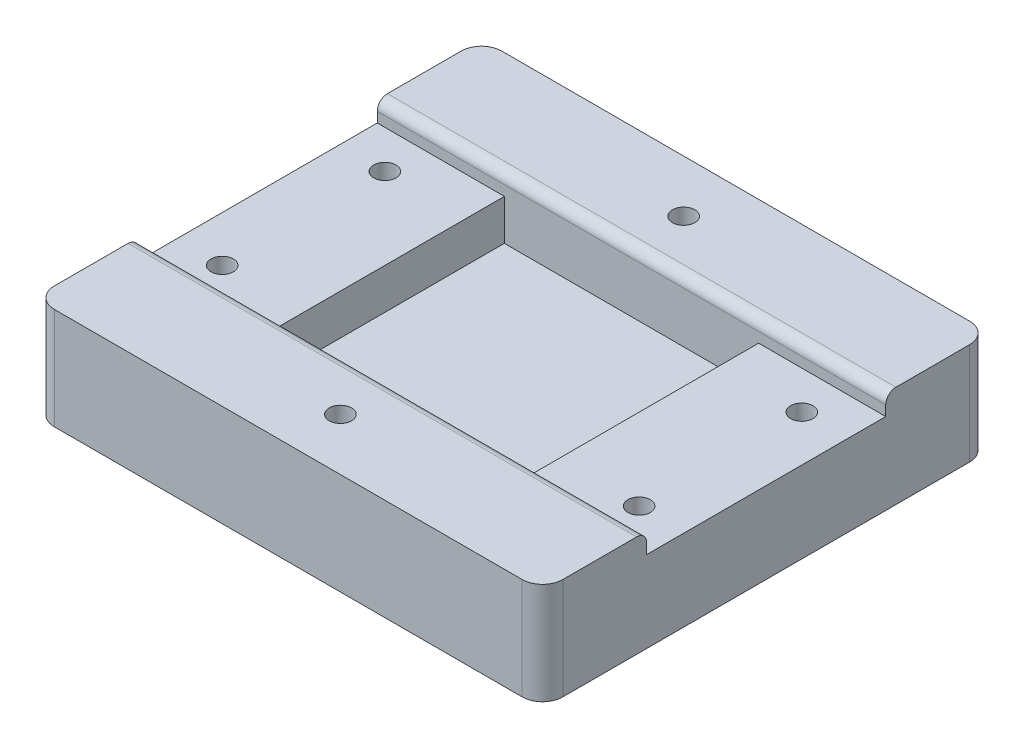
from build123d import *

# Parameters (mm, degrees)
CROQUIS1_W              = 50
CROQUIS1_H              = 44
SALIENTE_EXTRUIR1_DEPTH = 10
CROQUIS2_W              = 58
CROQUIS2_H              = 23.5
CORTAR_EXTRUIR2_DEPTH   = 2
CROQUIS3_W              = 25
CROQUIS3_H              = 23.5
CORTAR_EXTRUIR3_DEPTH   = 4
CROQUIS4_R              = 1.1
CORTAR_EXTRUIR4_DEPTH   = 5
CROQUIS5_R              = 1.1
CORTAR_EXTRUIR5_DEPTH   = 5
REDONDEO1_R             = 2
REDONDEO2_R             = 1


with BuildPart() as part:
    # Croquis1 → Saliente-Extruir1 (new body)
    with BuildSketch(Plane(origin=(0, 0, 0), x_dir=(1, 0, 0), z_dir=(0, 1, 0))):
        Rectangle(CROQUIS1_W, CROQUIS1_H)
    extrude(amount=SALIENTE_EXTRUIR1_DEPTH)

    # Croquis2 → Cortar-Extruir2 (cut)
    with BuildSketch(Plane(origin=(0, 10, 0), x_dir=(1, 0, 0), z_dir=(0, 1, 0))):
        Rectangle(CROQUIS2_W, CROQUIS2_H)
    extrude(amount=-CORTAR_EXTRUIR2_DEPTH, mode=Mode.SUBTRACT)

    # Croquis3 → Cortar-Extruir3 (cut)
    with BuildSketch(Plane(origin=(0, 8, 0), x_dir=(1, 0, 0), z_dir=(0, 1, 0))):
        Rectangle(CROQUIS3_W, CROQUIS3_H)
    extrude(amount=-CORTAR_EXTRUIR3_DEPTH, mode=Mode.SUBTRACT)

    # Croquis4 → Cortar-Extruir4 (cut)
    with BuildSketch(Plane(origin=(0, 8, 0), x_dir=(1, 0, 0), z_dir=(0, 1, 0))):
        with Locations(Location((-20.5, 8, 0), (0, 0, 270))):
            Circle(CROQUIS4_R)
        with Locations(Location((-20.5, -8, 0), (0, 0, 270))):
            Circle(CROQUIS4_R)
        with Locations(Location((20.5, 8, 0), (0, 0, 270))):
            Circle(CROQUIS4_R)
        with Locations(Location((20.5, -8, 0), (0, 0, 270))):
            Circle(CROQUIS4_R)
    extrude(amount=-CORTAR_EXTRUIR4_DEPTH, mode=Mode.SUBTRACT)

    # Croquis5 → Cortar-Extruir5 (cut)
    with BuildSketch(Plane(origin=(0, 10, 0), x_dir=(1, 0, 0), z_dir=(0, 1, 0))):
        with Locations(Location((0, 16.875, 0), (0, 0, 270))):
            Circle(CROQUIS5_R)
        with Locations(Location((0, -16.875, 0), (0, 0, 270))):
            Circle(CROQUIS5_R)
    extrude(amount=-CORTAR_EXTRUIR5_DEPTH, mode=Mode.SUBTRACT)

    # Redondeo1
    redondeo1_edges = [part.edges().sort_by_distance(p)[0] for p in [
        (-25, 5, -22),
        (25, 5, -22),
        (25, 5, 22),
        (-25, 5, 22),
    ]]
    fillet(redondeo1_edges, radius=REDONDEO1_R)

    # Redondeo2
    redondeo2_edges = [part.edges().sort_by_distance(p)[0] for p in [
        (0, 10, 11.75),
        (0, 10, -11.75),
    ]]
    fillet(redondeo2_edges, radius=REDONDEO2_R)


solid = part.part
